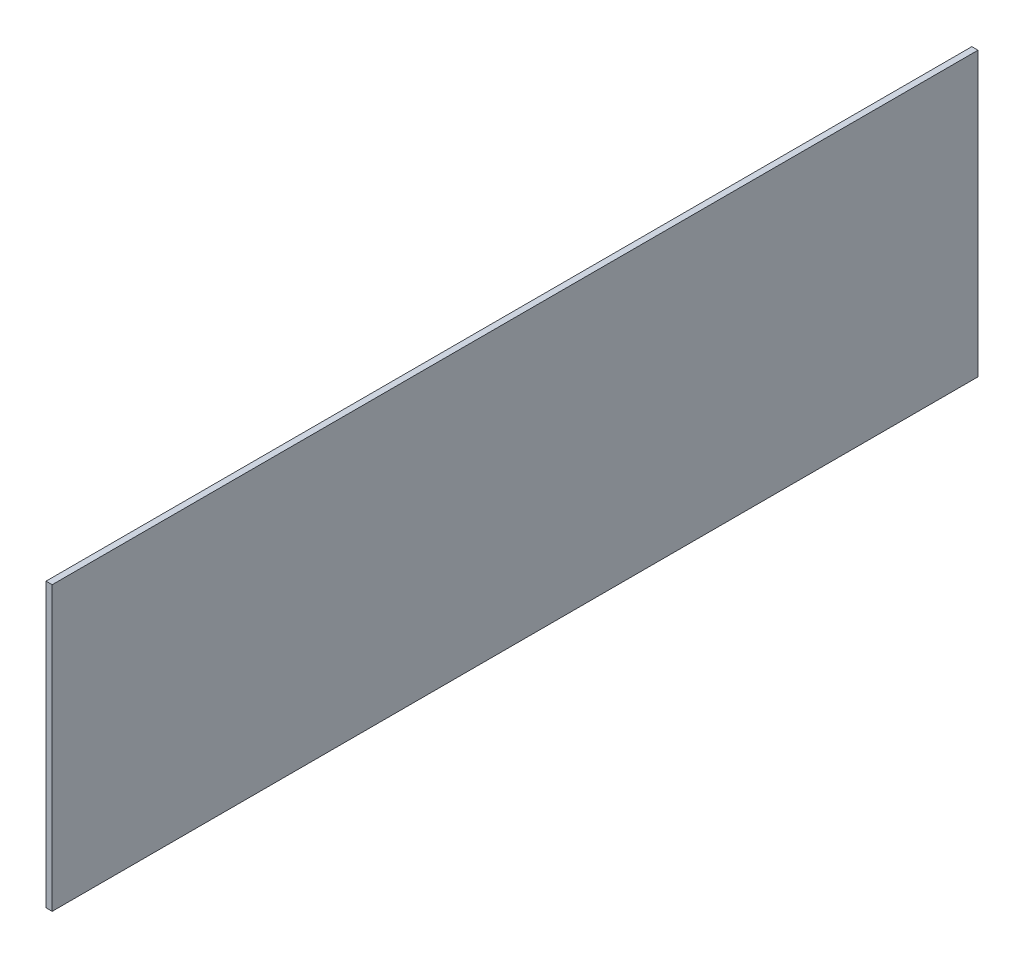
from build123d import *

# Parameters (mm, degrees)
SKETCH1_W           = 12
SKETCH1_H           = 550
BOSS_EXTRUDE1_DEPTH = 1800


with BuildPart() as part:
    # Sketch1 → Boss-Extrude1 (new body)
    with BuildSketch(Plane.XY):
        with Locations((-44.823529412, -144.411764706)):
            Rectangle(SKETCH1_W, SKETCH1_H)
    extrude(amount=BOSS_EXTRUDE1_DEPTH)


solid = part.part
